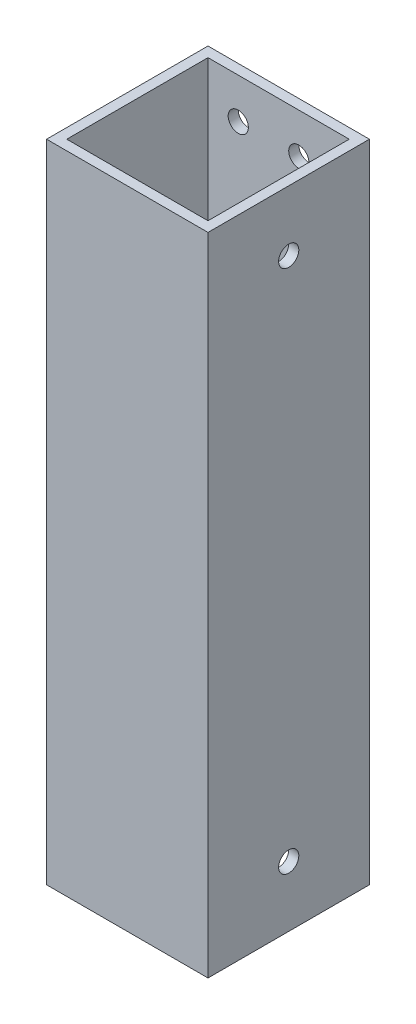
from build123d import *

# Parameters (mm, degrees)
SKETCH1_W           = 50.8
SKETCH1_H           = 50.8
SKETCH1_W_2         = 44.45
SKETCH1_H_2         = 44.45
BOSS_EXTRUDE1_DEPTH = 203.2
SKETCH2_R           = 3.175
CUT_EXTRUDE1_DEPTH  = 24.638
SKETCH3_R           = 3.175
CUT_EXTRUDE2_DEPTH  = 24.638


with BuildPart() as part:
    # Sketch1 → Boss-Extrude1 (new body)
    with BuildSketch(Plane(origin=(0, 0, 0), x_dir=(1, 0, 0), z_dir=(0, 1, 0))):
        with Locations((25.4, 25.4)):
            Rectangle(SKETCH1_W, SKETCH1_H)
        with Locations((25.4, 25.4)):
            Rectangle(SKETCH1_W_2, SKETCH1_H_2, mode=Mode.SUBTRACT)
    extrude(amount=BOSS_EXTRUDE1_DEPTH)

    # Sketch2 → Cut-Extrude1 (cut)
    with BuildSketch(Plane(origin=(0, 0, -50.8), x_dir=(-1, 0, 0), z_dir=(0, 0, -1))):
        with Locations((-12.7, 190.5)):
            Circle(SKETCH2_R)
        with Locations((-31.75, 190.5)):
            Circle(SKETCH2_R)
        with Locations((-31.75, 12.7)):
            Circle(SKETCH2_R)
        with Locations((-12.7, 12.7)):
            Circle(SKETCH2_R)
    extrude(amount=-CUT_EXTRUDE1_DEPTH, mode=Mode.SUBTRACT)

    # Sketch3 → Cut-Extrude2 (cut)
    with BuildSketch(Plane(origin=(50.8, 0, 0), x_dir=(0, 0, -1), z_dir=(1, 0, 0))):
        with Locations((25.4, 184.15)):
            Circle(SKETCH3_R)
        with Locations((25.4, 19.05)):
            Circle(SKETCH3_R)
    extrude(amount=-CUT_EXTRUDE2_DEPTH, mode=Mode.SUBTRACT)


solid = part.part
